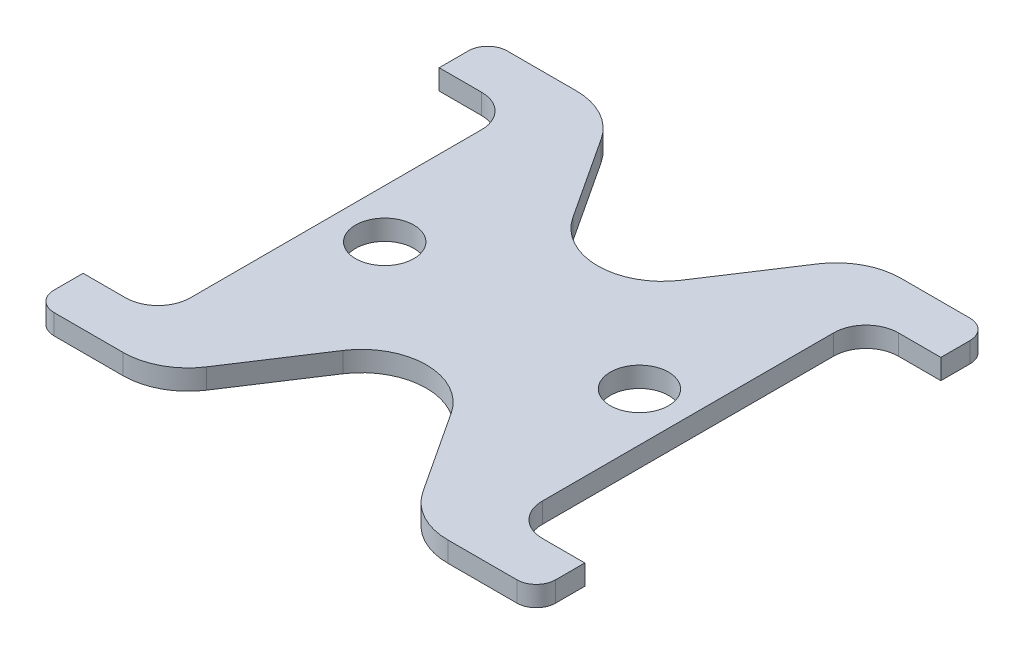
from build123d import *

# Parameters (mm, degrees)
SKETCH2_R           = 2.286
BOSS_EXTRUDE1_DEPTH = 1.5875
FILLET1_R           = 5.08
FILLET2_R           = 2.54
FILLET3_R           = 1.524


with BuildPart() as part:
    # Sketch2 → Boss-Extrude1 (new body)
    with BuildSketch(Plane.XZ.offset(32.657932219)):
        Polygon((10.109157694, -15.832760328), (13.919157694, -15.832760328), (19.794157694, -15.832760328), (19.794157694, -12.022760328), (13.919157694, -12.022760328), (13.919157694, 15.917239672), (19.794157694, 15.917239672), (19.794157694, 19.727239672), (13.919157694, 19.727239672), (10.109157694, 19.727239672), (0.109157694, 4.487239672), (-9.879450107, 19.727239672), (-13.700842306, 19.727239672), (-19.575842306, 19.727239672), (-19.575842306, 15.917239672), (-13.700842306, 15.917239672), (-13.700842306, -12.022760328), (-19.575842306, -12.022760328), (-19.575842306, -15.832760328), (-13.700842306, -15.832760328), (-9.879450107, -15.832760328), (0.109157694, -0.592760328), align=None)
        with Locations(Location((-9.879450107, 1.947239672, 0), (0, 0, 270))):
            Circle(SKETCH2_R, mode=Mode.SUBTRACT)
        with Locations(Location((10.109157694, 1.947239672, 0), (0, 0, 270))):
            Circle(SKETCH2_R, mode=Mode.SUBTRACT)
    extrude(amount=BOSS_EXTRUDE1_DEPTH)

    # Fillet1
    fillet1_edges = [part.edges().sort_by_distance(p)[0] for p in [
        (10.109157694, -33.451682219, 19.727239672),
        (10.109157694, -33.451682219, -15.832760328),
        (0.109157694, -33.451682219, -0.592760328),
        (-9.879450107, -33.451682219, -15.832760328),
        (-9.879450107, -33.451682219, 19.727239672),
        (0.109157694, -33.451682219, 4.487239672),
    ]]
    fillet(fillet1_edges, radius=FILLET1_R)

    # Fillet2
    fillet2_edges = [part.edges().sort_by_distance(p)[0] for p in [
        (13.919157694, -33.451682219, 15.917239672),
        (13.919157694, -33.451682219, -12.022760328),
        (-13.700842306, -33.451682219, -12.022760328),
        (-13.700842306, -33.451682219, 15.917239672),
    ]]
    fillet(fillet2_edges, radius=FILLET2_R)

    # Fillet3
    fillet3_edges = [part.edges().sort_by_distance(p)[0] for p in [
        (19.794157694, -33.451682219, 19.727239672),
        (19.794157694, -33.451682219, -15.832760328),
        (-19.575842306, -33.451682219, -15.832760328),
        (-19.575842306, -33.451682219, 19.727239672),
    ]]
    fillet(fillet3_edges, radius=FILLET3_R)


solid = part.part
